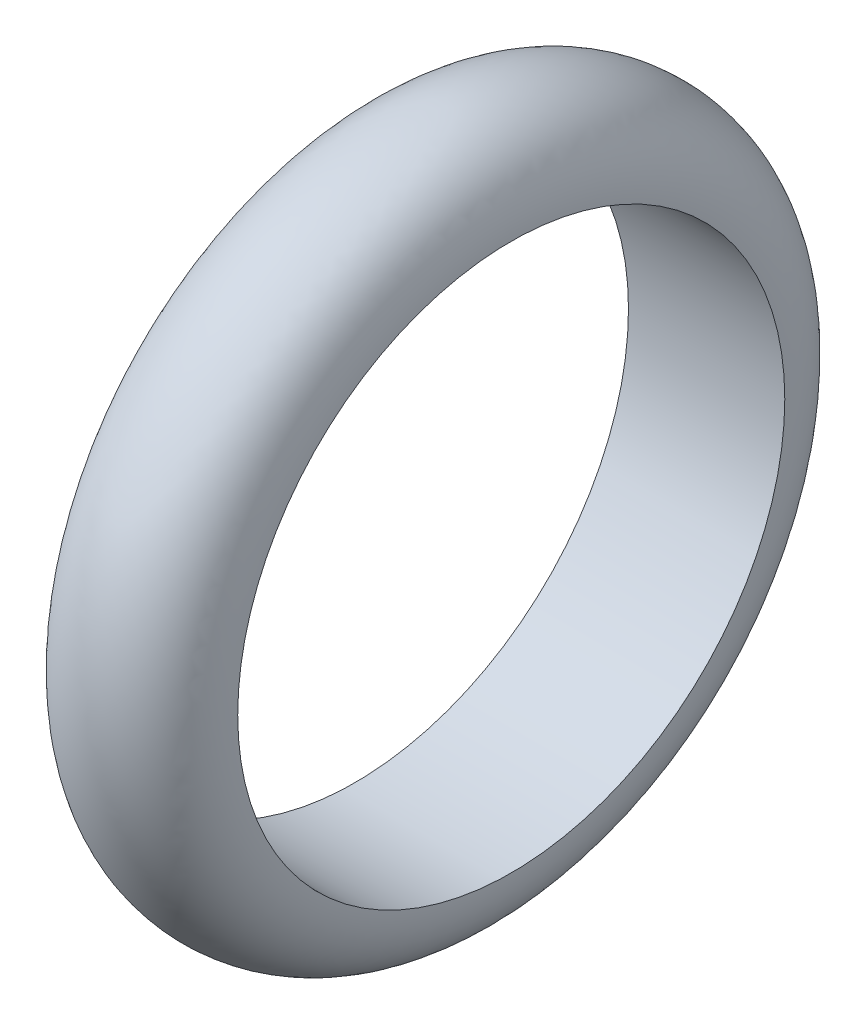
from build123d import *


with BuildPart() as part:
    # Sketch1 → Revolve1 (revolve)
    with BuildSketch(Plane(origin=(0, 0, 0), x_dir=(1, 0, 0), z_dir=(0, 1, 0)), mode=Mode.PRIVATE) as revolve1_sk:
        with BuildLine():
            Line((0, 44.45), (25.4, 44.45))
            add(Edge.make_bspline(
                [(0, 44.45), (0, 61.633421308), (25.4, 61.633421308), (25.4, 44.45)],
                knots=[0, 0, 0, 0, 1, 1, 1, 1], degree=3))
        make_face()
    revolve(revolve1_sk.sketch.rotate(Axis((0, 0, 0), (1, 0, 0)), 180), axis=Axis((0, 0, 0), (1, 0, 0)))


solid = part.part
